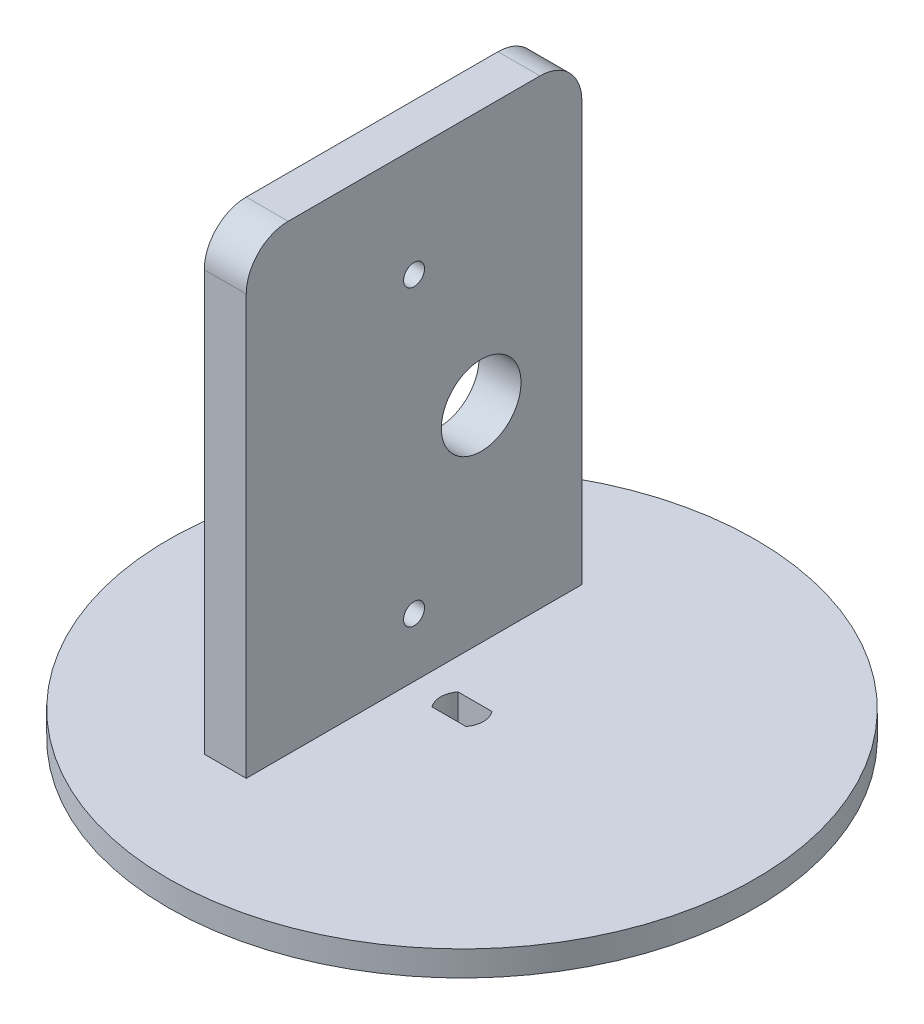
from build123d import *

# Parameters (mm, degrees)
CROQUIS1_R              = 35
SALIENTE_EXTRUIR1_DEPTH = 3
SALIENTE_EXTRUIR2_START = 6
CROQUIS2_R              = 7.5
SALIENTE_EXTRUIR2_DEPTH = 6
CROQUIS3_R              = 1.25
CORTAR_EXTRUIR1_DEPTH   = 6
CROQUIS4_W              = 5
CROQUIS4_H              = 40
SALIENTE_EXTRUIR3_DEPTH = 55
CROQUIS5_R              = 1.25
CROQUIS5_R_2            = 4.75
CORTAR_EXTRUIR2_DEPTH   = 5
REDONDEO1_R             = 5


with BuildPart() as part:
    # Croquis1 → Saliente-Extruir1 (new body)
    with BuildSketch(Plane(origin=(0, 0, 0), x_dir=(1, 0, 0), z_dir=(0, 1, 0))):
        with Locations(Location((0, 0, 0), (0, 0, 270))):
            Circle(CROQUIS1_R)
        with BuildLine():
            Line((-2.024845673, 1.55), (2.024845673, 1.55))
            ThreePointArc((2.024845673, 1.55), (2.55, 0), (2.024845673, -1.55))
            Line((2.024845673, -1.55), (-2.024845673, -1.55))
            ThreePointArc((-2.024845673, -1.55), (-2.55, 0), (-2.024845673, 1.55))
        make_face(mode=Mode.SUBTRACT)
    extrude(amount=SALIENTE_EXTRUIR1_DEPTH)

    # Croquis2 → Saliente-Extruir2 (add)
    with BuildSketch(Plane.XZ.offset(SALIENTE_EXTRUIR2_START)):
        with Locations(Location((0, 0, 0), (0, 0, 90))):
            Circle(CROQUIS2_R)
        with BuildLine():
            Line((-2.024845673, 1.55), (2.024845673, 1.55))
            ThreePointArc((2.024845673, 1.55), (2.55, 0), (2.024845673, -1.55))
            Line((2.024845673, -1.55), (-2.024845673, -1.55))
            ThreePointArc((-2.024845673, -1.55), (-2.55, 0), (-2.024845673, 1.55))
        make_face(mode=Mode.SUBTRACT)
    extrude(amount=-SALIENTE_EXTRUIR2_DEPTH)

    # Croquis3 → Cortar-Extruir1 (cut)
    with BuildSketch(Plane(origin=(0, 0, 1.55), x_dir=(-1, 0, 0), z_dir=(0, 0, -1))):
        with Locations((0, -3)):
            Circle(CROQUIS3_R)
    extrude(amount=-CORTAR_EXTRUIR1_DEPTH, mode=Mode.SUBTRACT)

    # Croquis4 → Saliente-Extruir3 (add)
    with BuildSketch(Plane(origin=(0, 3, 0), x_dir=(1, 0, 0), z_dir=(0, 1, 0))):
        with Locations((-8.215048019, 0)):
            Rectangle(CROQUIS4_W, CROQUIS4_H)
    extrude(amount=SALIENTE_EXTRUIR3_DEPTH)

    # Croquis5 → Cortar-Extruir2 (cut)
    with BuildSketch(Plane.ZY.offset(10.715048019)):
        with Locations((0, 45)):
            Circle(CROQUIS5_R)
        with Locations((0, 10)):
            Circle(CROQUIS5_R)
        with Locations((-8, 27.5)):
            Circle(CROQUIS5_R_2)
    extrude(amount=-CORTAR_EXTRUIR2_DEPTH, mode=Mode.SUBTRACT)

    # Redondeo1
    redondeo1_edges = [part.edges().sort_by_distance(p)[0] for p in [
        (-8.215048019, 58, -20),
        (-8.215048019, 58, 20),
    ]]
    fillet(redondeo1_edges, radius=REDONDEO1_R)


solid = part.part
